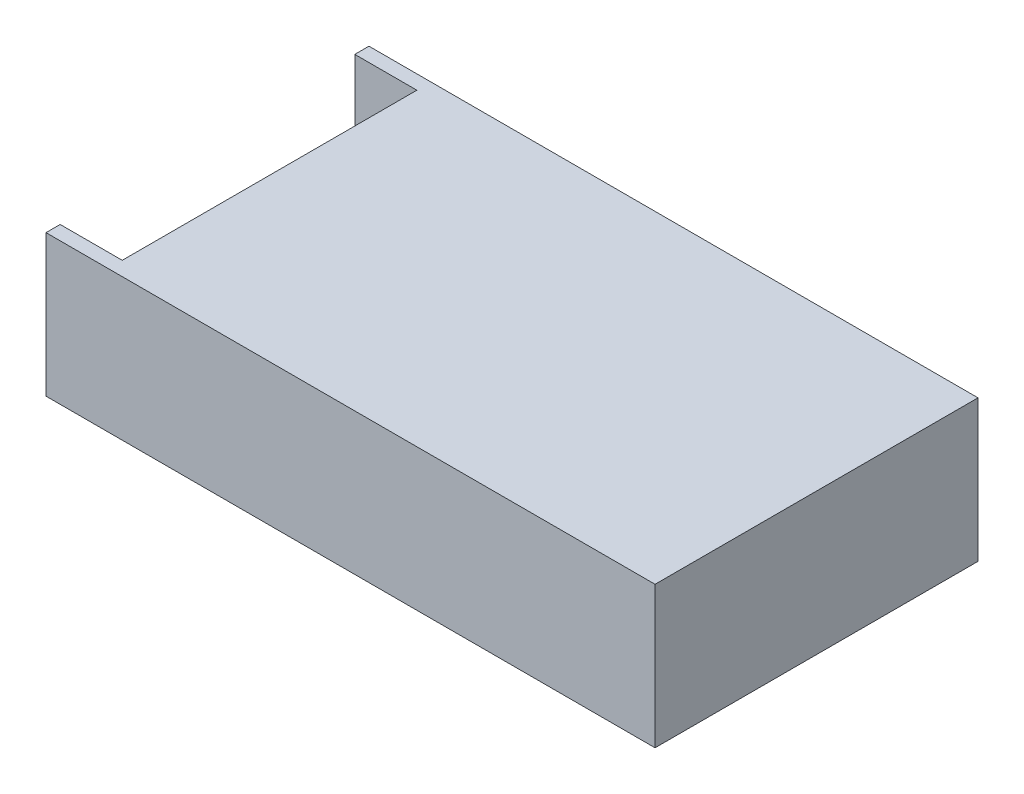
from build123d import *

# Parameters (mm, degrees)
ESBO_O1_W                = 215
ESBO_O1_H                = 114
RESSALTO_EXTRUS_O1_DEPTH = 50
CORTE_EXTRUS_O1_START    = -109
CORTE_EXTRUS_O1_DEPTH    = 104


with BuildPart() as part:
    # Esboço1 → Ressalto-extrusão1 (new body)
    with BuildSketch(Plane(origin=(0, 0, 0), x_dir=(1, 0, 0), z_dir=(0, 1, 0))):
        Rectangle(ESBO_O1_W, ESBO_O1_H)
    extrude(amount=RESSALTO_EXTRUS_O1_DEPTH)

    # Esboço3 → Corte-extrusão1 (cut)
    with BuildSketch(Plane.XY.offset(57).offset(CORTE_EXTRUS_O1_START)):
        Polygon((-107.5, 50), (-85.58523496, 50), (-85.58523496, 16.13389081), (-102.483117777, 16.13389081), (-102.483117777, 6.426889092), (-107.5, 6.426889092), (-107.5, 17.457061978), align=None)
    extrude(amount=CORTE_EXTRUS_O1_DEPTH, mode=Mode.SUBTRACT)


solid = part.part
